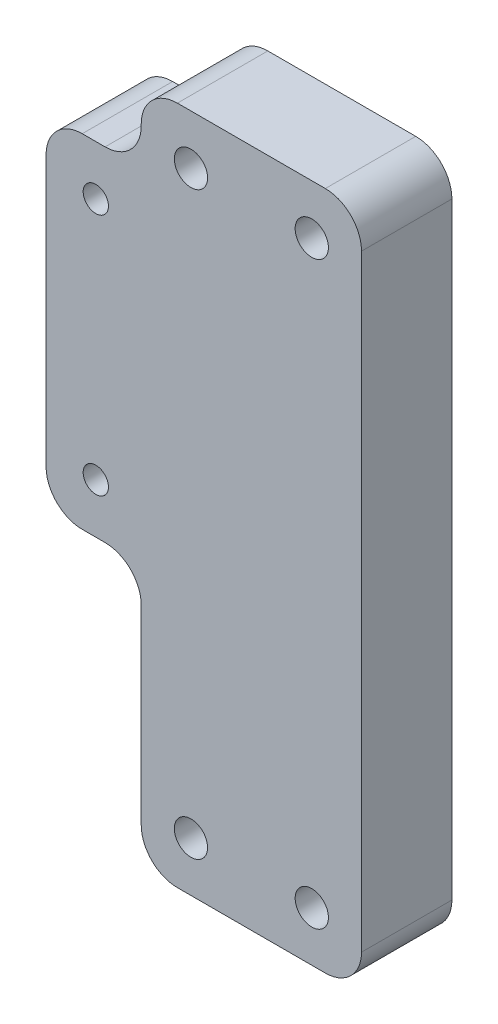
from build123d import *

# Parameters (mm, degrees)
SKETCH1_R           = 1.1684
SKETCH1_R_2         = 0.889
BOSS_EXTRUDE1_DEPTH = 6.35


with BuildPart() as part:
    # Sketch1 → Boss-Extrude1 (new body)
    with BuildSketch(Plane.XY):
        with BuildLine():
            Line((-31.453240404, -3.582490692), (-31.453240404, -46.222490692))
            ThreePointArc((-31.453240404, -46.222490692), (-32.197189179, -48.018541916), (-33.993240404, -48.762490692))
            Line((-33.993240404, -48.762490692), (-44.383240404, -48.762490692))
            ThreePointArc((-44.383240404, -48.762490692), (-46.179291628, -48.018541916), (-46.923240404, -46.222490692))
            Line((-46.923240404, -46.222490692), (-46.923240404, -32.850740692))
            ThreePointArc((-46.923240404, -32.850740692), (-47.667189179, -31.054689467), (-49.463240404, -30.310740692))
            Line((-49.463240404, -30.310740692), (-51.065740404, -30.310740692))
            ThreePointArc((-51.065740404, -30.310740692), (-52.861791628, -29.566791916), (-53.605740404, -27.770740692))
            Line((-53.605740404, -27.770740692), (-53.605740404, -8.784240692))
            ThreePointArc((-53.605740404, -8.784240692), (-52.861791628, -6.988189467), (-51.065740404, -6.244240692))
            Line((-51.065740404, -6.244240692), (-49.463240404, -6.244240692))
            ThreePointArc((-49.463240404, -6.244240692), (-47.667189179, -5.500291916), (-46.923240404, -3.704240692))
            Line((-46.923240404, -3.704240692), (-46.923240404, -3.582490692))
            ThreePointArc((-46.923240404, -3.582490692), (-46.179291628, -1.786439467), (-44.383240404, -1.042490692))
            Line((-44.383240404, -1.042490692), (-33.993240404, -1.042490692))
            ThreePointArc((-33.993240404, -1.042490692), (-32.197189179, -1.786439467), (-31.453240404, -3.582490692))
        make_face()
        with Locations((-43.430740404, -4.534990692)):
            Circle(SKETCH1_R, mode=Mode.SUBTRACT)
        with Locations((-34.945740404, -4.534990692)):
            Circle(SKETCH1_R, mode=Mode.SUBTRACT)
        with Locations((-43.430740404, -45.269990692)):
            Circle(SKETCH1_R, mode=Mode.SUBTRACT)
        with Locations((-34.945740404, -45.269990692)):
            Circle(SKETCH1_R, mode=Mode.SUBTRACT)
        with Locations((-50.113240404, -9.736740692)):
            Circle(SKETCH1_R_2, mode=Mode.SUBTRACT)
        with Locations((-50.113240404, -26.818240692)):
            Circle(SKETCH1_R_2, mode=Mode.SUBTRACT)
    extrude(amount=BOSS_EXTRUDE1_DEPTH)


solid = part.part
